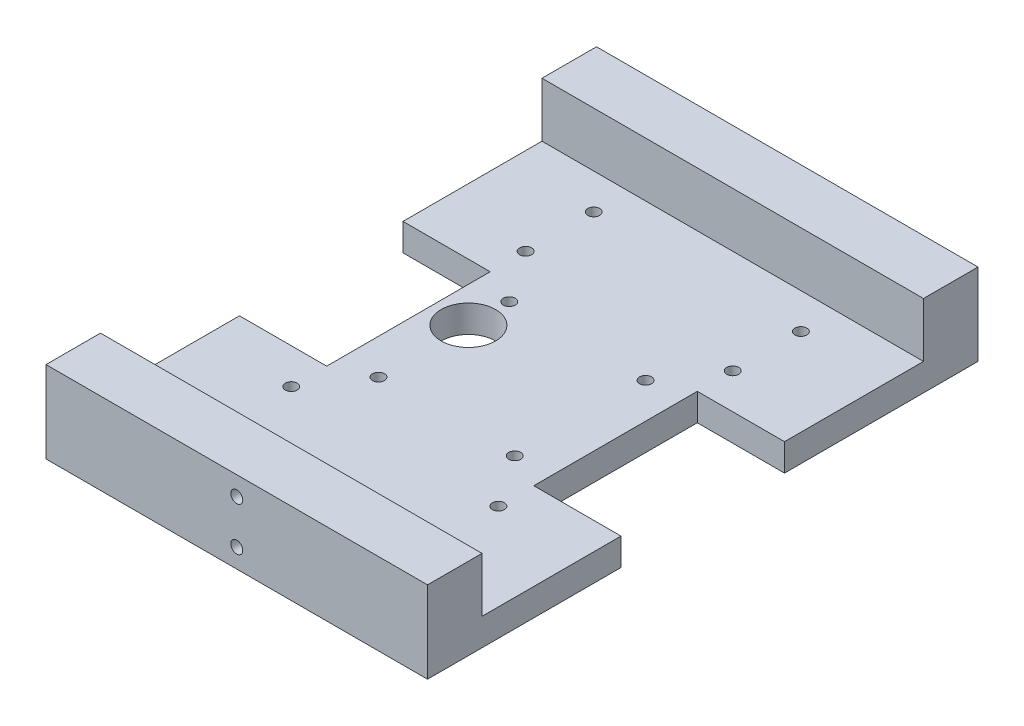
from build123d import *

# Parameters (mm, degrees)
SKETCH_1_W           = 70
SKETCH_1_H           = 101
EXTRUDE_1_DEPTH      = 15
SKETCH_3_W           = 70
SKETCH_3_H           = 81
CUT_EXTRUDE_2_DEPTH  = 10
F_1_0MM_1_AT_2_COUNT = 2
F_1_0MM_1_AT_2_PITCH = 8
SKETCH_7_W           = 16
SKETCH_7_H           = 30
CUT_EXTRUDE_3_DEPTH  = 63.251506006
F_1_0MM_3_D          = 2.2
SKETCH_11_R          = 5
CUT_EXTRUDE_4_DEPTH  = 64.247529596
F_1_0MM_2_D          = 2.2


with BuildPart() as part:
    # 草圖1 → 填料-伸長1 (new body)
    with BuildSketch(Plane(origin=(0, 0, 0), x_dir=(1, 0, 0), z_dir=(0, 1, 0))):
        Rectangle(SKETCH_1_W, SKETCH_1_H)
    extrude(amount=EXTRUDE_1_DEPTH)

    # 草圖3 → 除料-伸長2 (cut)
    with BuildSketch(Plane(origin=(0, 15, 0), x_dir=(1, 0, 0), z_dir=(0, 1, 0))):
        Rectangle(SKETCH_3_W, SKETCH_3_H)
    extrude(amount=-CUT_EXTRUDE_2_DEPTH, mode=Mode.SUBTRACT)

    # 草圖6 → Ø1.0mm 定位孔1 (revolve, cut)
    with BuildSketch(Plane(origin=(0, 3.5, -50.5), x_dir=(0, 1, 0), z_dir=(1, 0, 0))):
        Polygon((0, 0), (0, 7.010946681), (1.1, 6.35), (1.1, 0), align=None)
    f_1_0mm_1 = revolve(axis=Axis((0, 3.5, -56.85), (0, 0, 1)), mode=Mode.SUBTRACT)

    # Ø1.0mm 定位孔1 at 2: Ø1.0mm 定位孔1 ×2
    with Locations(*[(0, i * F_1_0MM_1_AT_2_PITCH, 0) for i in range(1, F_1_0MM_1_AT_2_COUNT)]):
        add(f_1_0mm_1, mode=Mode.SUBTRACT)

    # 鏡射1: Ø1.0mm 定位孔1 across plane
    add(f_1_0mm_1.mirror(Plane.XY), mode=Mode.SUBTRACT)

    # 鏡射1 copy 1 sketch → 鏡射1 copy 1 (revolve, cut)
    with BuildSketch(Plane(origin=(0, 11.5, 50.5), x_dir=(0, 1, 0), z_dir=(1, 0, 0))):
        Polygon((0, 0), (0, -7.010946681), (1.1, -6.35), (1.1, 0), align=None)
    revolve(axis=Axis((0, 11.5, 56.85), (0, 0, 1)), mode=Mode.SUBTRACT)

    # 草圖7 → 除料-伸長3 (cut, through all)
    with BuildSketch(Plane(origin=(0, 5, 0), x_dir=(1, 0, 0), z_dir=(0, 1, 0))):
        with Locations((27, 0)):
            Rectangle(SKETCH_7_W, SKETCH_7_H)
    cut_extrude_3 = extrude(amount=-CUT_EXTRUDE_3_DEPTH, mode=Mode.SUBTRACT)

    # 鏡射2: 除料-伸長3 across plane
    add(cut_extrude_3.mirror(Plane(origin=(0, 0, 0), x_dir=(0, 0, 1), z_dir=(1, 0, 0))), mode=Mode.SUBTRACT)

    # Ø1.0mm 定位孔3 (through all)
    with Locations(Plane(origin=(0, 0, 0), x_dir=(-1, 0, 0), z_dir=(0, -1, 0))):
        with Locations((-12.5, -12), (12.5, -12), (-12.5, 12), (12.5, 12)):
            Hole(F_1_0MM_3_D / 2)

    # 草圖11 → 除料-伸長4 (cut, through all)
    with BuildSketch(Plane.XZ):
        with Locations(Location((-12.5, -4.5, 0), (0, 0, 270))):
            Circle(SKETCH_11_R)
    extrude(amount=-CUT_EXTRUDE_4_DEPTH, mode=Mode.SUBTRACT)

    # Ø1.0mm 定位孔2 (through all)
    with Locations(Plane(origin=(0, 5, 0), x_dir=(1, 0, 0), z_dir=(0, 1, 0))):
        with Locations((-19, 34), (-19, 21.5), (19, 21.5), (19, 34)):
            f_1_0mm_2 = Hole(F_1_0MM_2_D / 2)

    # 鏡射3: Ø1.0mm 定位孔2 across plane
    add(f_1_0mm_2.mirror(Plane.XY), mode=Mode.SUBTRACT)


solid = part.part
